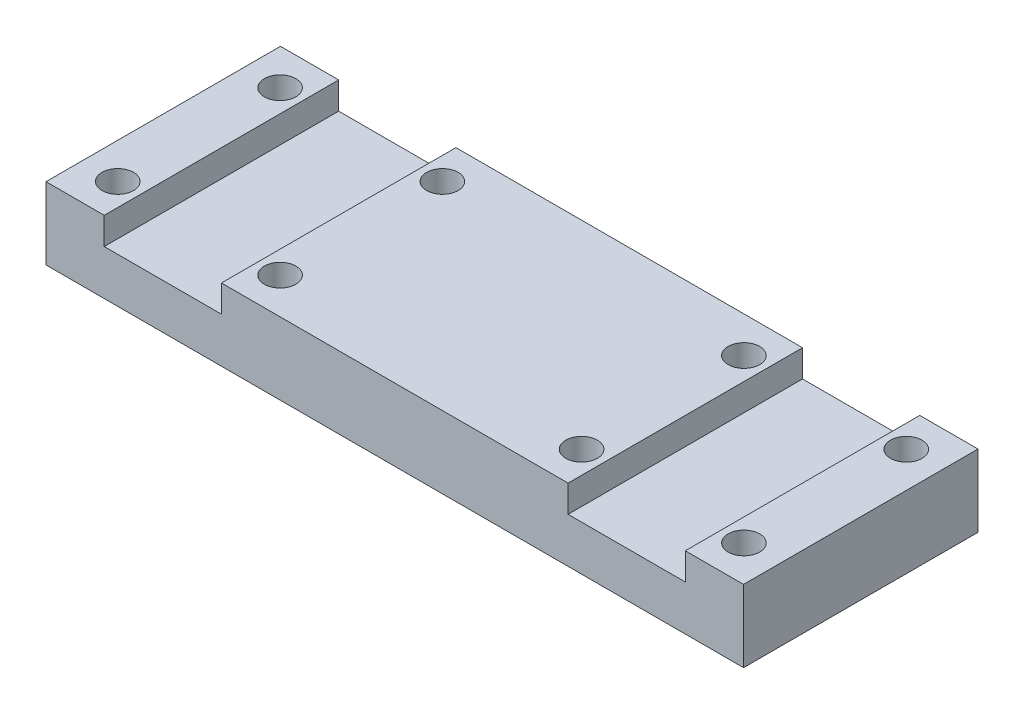
from build123d import *

# Parameters (mm, degrees)
SKETCH1_W           = 154.7
SKETCH1_H           = 52
BOSS_EXTRUDE1_DEPTH = 16
SKETCH3_R           = 3.5
CUT_EXTRUDE2_DEPTH  = 84.156614289
SKETCH5_W           = 26
SKETCH5_H           = 6
CUT_EXTRUDE4_DEPTH  = 95.567555218


with BuildPart() as part:
    # Sketch1 → Boss-Extrude1 (new body)
    with BuildSketch(Plane(origin=(0, 0, 0), x_dir=(1, 0, 0), z_dir=(0, 1, 0))):
        Rectangle(SKETCH1_W, SKETCH1_H)
    extrude(amount=BOSS_EXTRUDE1_DEPTH)

    # Sketch3 → Cut-Extrude2 (cut, through all)
    with BuildSketch(Plane(origin=(0, 16, 0), x_dir=(1, 0, 0), z_dir=(0, 1, 0))):
        with Locations(Location((-69.435638509, 18, 0), (0, 0, 270))):
            Circle(SKETCH3_R)
        with Locations(Location((-33.435638509, 18, 0), (0, 0, 270))):
            Circle(SKETCH3_R)
        with Locations(Location((-33.435638509, -18, 0), (0, 0, 270))):
            Circle(SKETCH3_R)
        with Locations(Location((-69.435638509, -18, 0), (0, 0, 270))):
            Circle(SKETCH3_R)
    cut_extrude2 = extrude(amount=-CUT_EXTRUDE2_DEPTH, mode=Mode.SUBTRACT)

    # Mirror1: Cut-Extrude2 across plane
    add(cut_extrude2.mirror(Plane.ZY), mode=Mode.SUBTRACT)

    # Sketch5 → Cut-Extrude4 (cut, through all)
    with BuildSketch(Plane.XY.offset(26)):
        with Locations((-51.435638509, 13)):
            Rectangle(SKETCH5_W, SKETCH5_H)
    cut_extrude4 = extrude(amount=-CUT_EXTRUDE4_DEPTH, mode=Mode.SUBTRACT)

    # Mirror2: Cut-Extrude4 across plane
    add(cut_extrude4.mirror(Plane.ZY), mode=Mode.SUBTRACT)


solid = part.part
